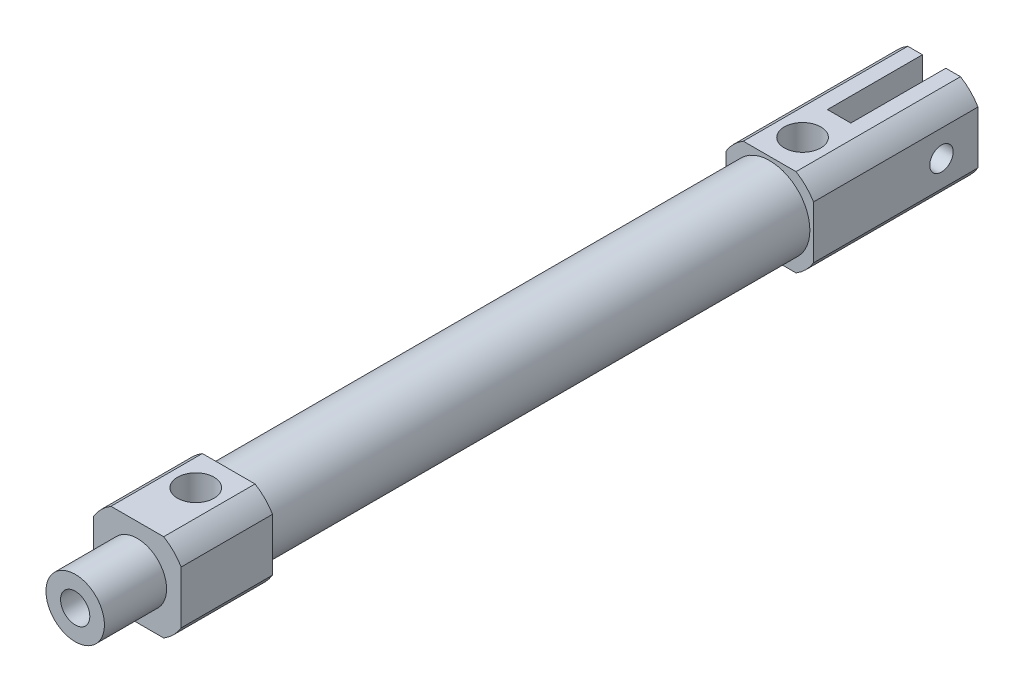
from build123d import *

# Parameters (mm, degrees)
SKETCH_1_R          = 7
EXTRUDE_1_DEPTH     = 22.5
SKETCH_2_R          = 5.5
SKETCH_2_R_2        = 5
EXTRUDE_2_DEPTH     = 74
SKETCH_3_R          = 7
EXTRUDE_3_DEPTH     = 12.5
SKETCH_4_R          = 4
EXTRUDE_4_DEPTH     = 8.5
SKETCH_5_R          = 2
CUT_EXTRUDE_1_DEPTH = 50
SKETCH_6_R          = 10
SKETCH_6_W          = 12
SKETCH_6_H          = 12
CUT_EXTRUDE_2_DEPTH = 110.448618082
SKETCH_7_W          = 3.2
SKETCH_7_H          = 12
CUT_EXTRUDE_3_DEPTH = 13
SKETCH_8_R          = 1.6
CUT_EXTRUDE_4_DEPTH = 119.263477033
SKETCH_9_R          = 2.5
CUT_EXTRUDE_5_DEPTH = 5
SKETCH_10_R         = 2.5
CUT_EXTRUDE_6_DEPTH = 5


with BuildPart() as part:
    # 草图1 → 凸台-拉伸1 (new body)
    with BuildSketch(Plane.XY):
        with Locations(Location((0, 0, 0), (0, 0, 180))):
            Circle(SKETCH_1_R)
    extrude(amount=EXTRUDE_1_DEPTH)

    # 草图2 → 凸台-拉伸2 (add)
    with BuildSketch(Plane.XY.offset(22.5)):
        Circle(SKETCH_2_R)
        Circle(SKETCH_2_R_2, mode=Mode.SUBTRACT)
    extrude(amount=EXTRUDE_2_DEPTH)

    # 草图3 → 凸台-拉伸3 (add)
    with BuildSketch(Plane.XY.offset(96.5)):
        with Locations(Location((0, 0, 0), (0, 0, 180))):
            Circle(SKETCH_3_R)
    extrude(amount=EXTRUDE_3_DEPTH)

    # 草图4 → 凸台-拉伸4 (add)
    with BuildSketch(Plane.XY.offset(109)):
        Circle(SKETCH_4_R)
    extrude(amount=EXTRUDE_4_DEPTH)

    # 草图5 → 切除-拉伸1 (cut)
    with BuildSketch(Plane.XY.offset(117.5)):
        Circle(SKETCH_5_R)
    extrude(amount=-CUT_EXTRUDE_1_DEPTH, mode=Mode.SUBTRACT)

    # 草图6 → 切除-拉伸2 (cut, through all)
    with BuildSketch(Plane.XY.offset(109)):
        Circle(SKETCH_6_R)
        Rectangle(SKETCH_6_W, SKETCH_6_H, mode=Mode.SUBTRACT)
    extrude(amount=-CUT_EXTRUDE_2_DEPTH, mode=Mode.SUBTRACT)

    # 草图7 → 切除-拉伸3 (cut)
    with BuildSketch(Plane(origin=(0, 0, 0), x_dir=(-1, 0, 0), z_dir=(0, 0, -1))):
        Rectangle(SKETCH_7_W, SKETCH_7_H)
    extrude(amount=-CUT_EXTRUDE_3_DEPTH, mode=Mode.SUBTRACT)

    # 草图8 → 切除-拉伸4 (cut, through all)
    with BuildSketch(Plane(origin=(6, 0, 0), x_dir=(0, 0, -1), z_dir=(1, 0, 0))):
        with Locations((-5, 0)):
            Circle(SKETCH_8_R)
    extrude(amount=-CUT_EXTRUDE_4_DEPTH, mode=Mode.SUBTRACT)

    # 草图9 → 切除-拉伸5 (cut)
    with BuildSketch(Plane(origin=(0, 6, 0), x_dir=(1, 0, 0), z_dir=(0, 1, 0))):
        with Locations(Location((0, -18, 0), (0, 0, 270))):
            Circle(SKETCH_9_R)
    extrude(amount=-CUT_EXTRUDE_5_DEPTH, mode=Mode.SUBTRACT)

    # 草图10 → 切除-拉伸6 (cut)
    with BuildSketch(Plane(origin=(0, 6, 0), x_dir=(1, 0, 0), z_dir=(0, 1, 0))):
        with Locations(Location((0, -101, 0), (0, 0, 270))):
            Circle(SKETCH_10_R)
    extrude(amount=-CUT_EXTRUDE_6_DEPTH, mode=Mode.SUBTRACT)


solid = part.part
